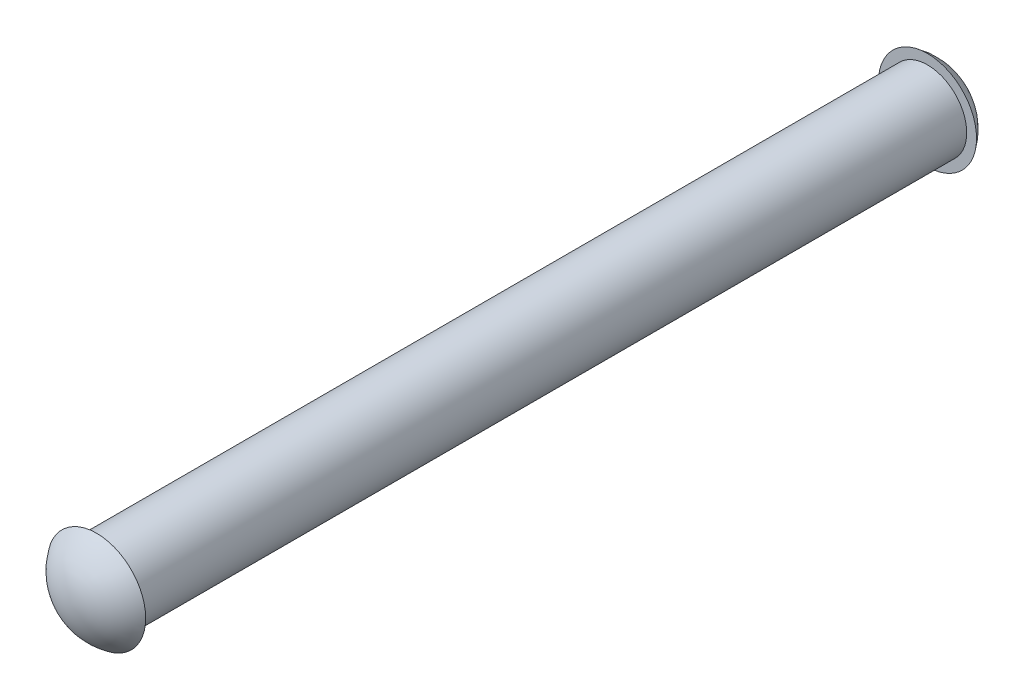
from build123d import *

# Parameters (mm, degrees)
CROQUIS1_R              = 1.2
SALIENTE_EXTRUIR1_DEPTH = 12.7


with BuildPart() as part:
    # Croquis1 → Saliente-Extruir1 (new, symmetric)
    with BuildSketch(Plane.XY):
        Circle(CROQUIS1_R)
    extrude(amount=SALIENTE_EXTRUIR1_DEPTH, both=True)

    # Croquis4 → Revolución1 (revolve)
    with BuildSketch(Plane(origin=(0, 0, 0), x_dir=(1, 0, 0), z_dir=(0, 1, 0))):
        with BuildLine():
            Line((0, -13.5), (0, -12.7))
            Line((0, -12.7), (-1.5, -12.7))
            ThreePointArc((-1.5, -12.7), (-0.85, -13.2875), (0, -13.5))
        make_face()
    revoluci_n1 = revolve(axis=Axis((0, 0, 13.5), (0, 0, -1)))

    # Simetría1: Revolución1 across plane
    add(revoluci_n1.mirror(Plane.XY))


solid = part.part
